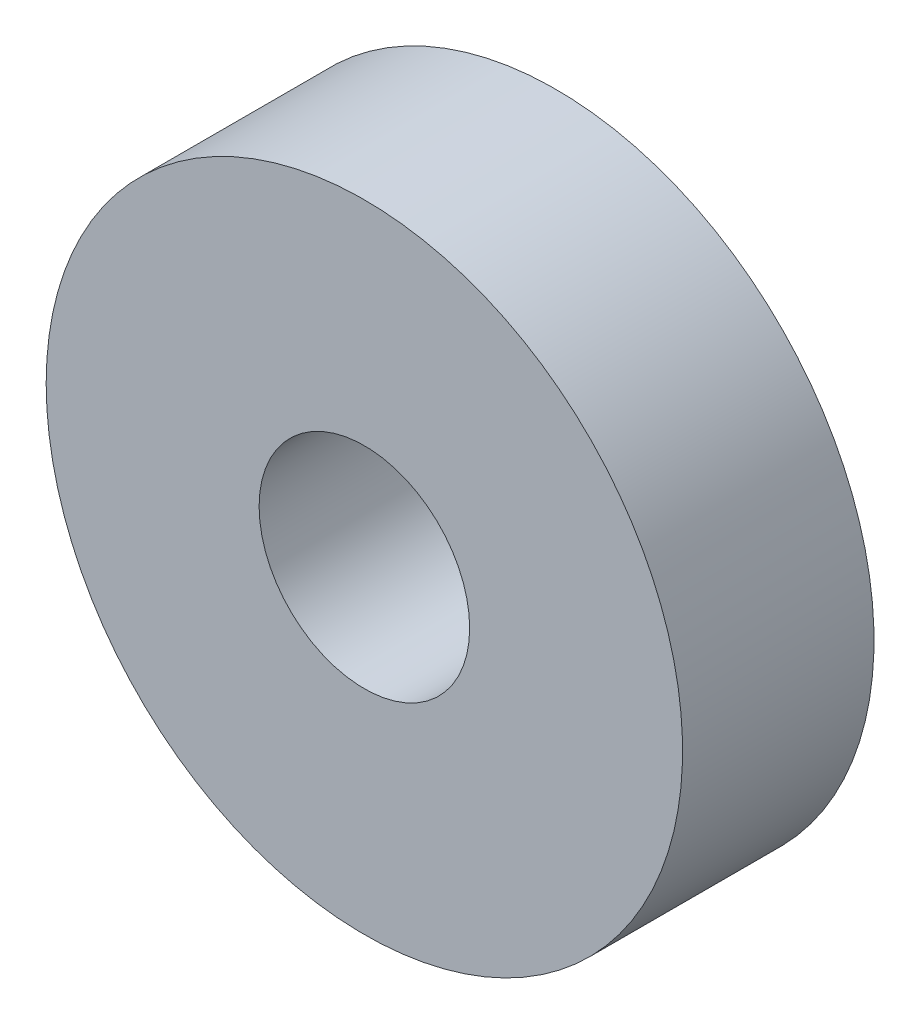
from build123d import *

# Parameters (mm, degrees)
SKETCH_1_W          = 3.637162012
SKETCH_1_H          = 3
SKETCH_2_R          = 1.65
CUT_EXTRUDE_1_DEPTH = 8.664435392


with BuildPart() as part:
    # 草图1 → 旋转1 (revolve)
    with BuildSketch(Plane.XZ, mode=Mode.PRIVATE) as revolve_1_sk:
        with Locations((3.168581006, 1.5)):
            Rectangle(SKETCH_1_W, SKETCH_1_H)
    revolve(revolve_1_sk.sketch.rotate(Axis((0, 0, 3), (0, 0, -1)), 180), axis=Axis((0, 0, 3), (0, 0, -1)))

    # 草图2 → 切除-拉伸1 (cut, through all)
    with BuildSketch(Plane.XY.offset(3)):
        Circle(SKETCH_2_R)
    extrude(amount=-CUT_EXTRUDE_1_DEPTH, mode=Mode.SUBTRACT)


solid = part.part
